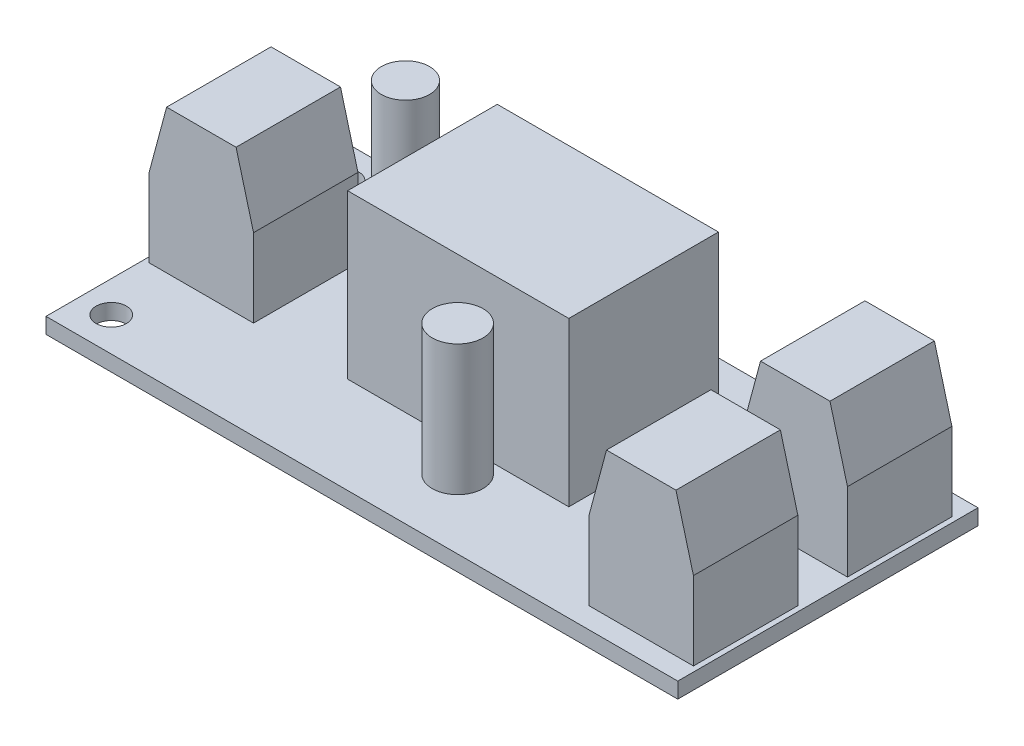
from build123d import *
from OCP.BRepFilletAPI import BRepFilletAPI_MakeChamfer

# Parameters (mm, degrees)
SKETCH1_W                   = 61.468
SKETCH1_H                   = 29.21
BOSS_EXTRUDE1_DEPTH         = 0.762
F_32_0_116_DIAMETER_HOLE1_D = 2.9464
SKETCH4_W                   = 10.16
SKETCH4_H                   = 10.16
BOSS_EXTRUDE2_DEPTH         = 13.97
SKETCH5_W                   = 10.16
SKETCH5_H                   = 10.16
BOSS_EXTRUDE3_DEPTH         = 13.97
CHAMFER1_SIZE               = 6.35
CHAMFER1_SIZE2              = 1.701477372
SKETCH6_R                   = 2.3495
BOSS_EXTRUDE4_DEPTH         = 12.7
SKETCH7_W                   = 21.517957465
SKETCH7_H                   = 14.561058099
BOSS_EXTRUDE5_DEPTH         = 15.875
SKETCH8_R                   = 2.468766422
BOSS_EXTRUDE6_DEPTH         = 12.7


with BuildPart() as part:
    # Sketch1 → Boss-Extrude1 (new, symmetric)
    with BuildSketch(Plane(origin=(0, 0, 0), x_dir=(1, 0, 0), z_dir=(0, 1, 0))):
        Rectangle(SKETCH1_W, SKETCH1_H)
    extrude(amount=BOSS_EXTRUDE1_DEPTH, both=True)

    # #32 (0.116) Diameter Hole1 (through all)
    with Locations(Plane(origin=(0, 0.762, 0), x_dir=(1, 0, 0), z_dir=(0, 1, 0))):
        with Locations((-27.686, 11.303), (-27.686, -11.303)):
            Hole(F_32_0_116_DIAMETER_HOLE1_D / 2)

    # Sketch4 → Boss-Extrude2 (add)
    with BuildSketch(Plane(origin=(0, 0.762, 0), x_dir=(1, 0, 0), z_dir=(0, 1, 0))):
        with Locations((-25.146, 0)):
            Rectangle(SKETCH4_W, SKETCH4_H)
    extrude(amount=BOSS_EXTRUDE2_DEPTH)

    # Sketch5 → Boss-Extrude3 (add)
    with BuildSketch(Plane(origin=(0, 0.762, 0), x_dir=(1, 0, 0), z_dir=(0, 1, 0))):
        with Locations((25.146, 7.493)):
            Rectangle(SKETCH5_W, SKETCH5_H)
        with Locations((25.146, -7.493)):
            Rectangle(SKETCH5_W, SKETCH5_H)
    extrude(amount=BOSS_EXTRUDE3_DEPTH)

    # Chamfer1: one chamfer whose edges measure the first distance from different faces: ONE call of the kernel's chamfer builder (chamfer() names one face for all edges)
    chamfer1_edges_1 = [part.edges().sort_by_distance(p)[0] for p in [
        (-30.226, 14.732, 0),
    ]]
    chamfer1_side_1 = [part.faces().sort_by_distance(p)[0] for p in [
        (-30.226, 7.747, 0),
    ]]
    chamfer1_edges_2 = [part.edges().sort_by_distance(p)[0] for p in [
        (-20.066, 14.732, 0),
    ]]
    chamfer1_side_2 = [part.faces().sort_by_distance(p)[0] for p in [
        (-20.066, 7.747, 0),
    ]]
    chamfer1_edges_3 = [part.edges().sort_by_distance(p)[0] for p in [
        (20.066, 14.732, -7.493),
    ]]
    chamfer1_side_3 = [part.faces().sort_by_distance(p)[0] for p in [
        (20.066, 7.747, -7.493),
    ]]
    chamfer1_edges_4 = [part.edges().sort_by_distance(p)[0] for p in [
        (30.226, 14.732, -7.493),
    ]]
    chamfer1_side_4 = [part.faces().sort_by_distance(p)[0] for p in [
        (30.226, 7.747, -7.493),
    ]]
    chamfer1_edges_5 = [part.edges().sort_by_distance(p)[0] for p in [
        (20.066, 14.732, 7.493),
    ]]
    chamfer1_side_5 = [part.faces().sort_by_distance(p)[0] for p in [
        (20.066, 7.747, 7.493),
    ]]
    chamfer1_edges_6 = [part.edges().sort_by_distance(p)[0] for p in [
        (30.226, 14.732, 7.493),
    ]]
    chamfer1_side_6 = [part.faces().sort_by_distance(p)[0] for p in [
        (30.226, 7.747, 7.493),
    ]]
    chamfer1 = BRepFilletAPI_MakeChamfer(part.part.solid().wrapped)
    for e in chamfer1_edges_1:
        chamfer1.Add(CHAMFER1_SIZE, CHAMFER1_SIZE2, e.wrapped, chamfer1_side_1[0].wrapped)  # the first distance lies on this face
    for e in chamfer1_edges_2:
        chamfer1.Add(CHAMFER1_SIZE, CHAMFER1_SIZE2, e.wrapped, chamfer1_side_2[0].wrapped)  # the first distance lies on this face
    for e in chamfer1_edges_3:
        chamfer1.Add(CHAMFER1_SIZE, CHAMFER1_SIZE2, e.wrapped, chamfer1_side_3[0].wrapped)  # the first distance lies on this face
    for e in chamfer1_edges_4:
        chamfer1.Add(CHAMFER1_SIZE, CHAMFER1_SIZE2, e.wrapped, chamfer1_side_4[0].wrapped)  # the first distance lies on this face
    for e in chamfer1_edges_5:
        chamfer1.Add(CHAMFER1_SIZE, CHAMFER1_SIZE2, e.wrapped, chamfer1_side_5[0].wrapped)  # the first distance lies on this face
    for e in chamfer1_edges_6:
        chamfer1.Add(CHAMFER1_SIZE, CHAMFER1_SIZE2, e.wrapped, chamfer1_side_6[0].wrapped)  # the first distance lies on this face
    add(Compound.cast(chamfer1.Shape()), mode=Mode.REPLACE)

    # Sketch6 → Boss-Extrude4 (add)
    with BuildSketch(Plane(origin=(0, 0.762, 0), x_dir=(1, 0, 0), z_dir=(0, 1, 0))):
        with Locations(Location((-20.420225117, 10.051406146, 0), (0, 0, 270))):
            Circle(SKETCH6_R)
    extrude(amount=BOSS_EXTRUDE4_DEPTH)

    # Sketch7 → Boss-Extrude5 (add)
    with BuildSketch(Plane(origin=(0, 0.762, 0), x_dir=(1, 0, 0), z_dir=(0, 1, 0))):
        with Locations((-0.009722788, 2.057247528)):
            Rectangle(SKETCH7_W, SKETCH7_H)
    extrude(amount=BOSS_EXTRUDE5_DEPTH)

    # Sketch8 → Boss-Extrude6 (add)
    with BuildSketch(Plane(origin=(0, 0.762, 0), x_dir=(1, 0, 0), z_dir=(0, 1, 0))):
        with Locations(Location((2.574570697, -7.864784458, 0), (0, 0, 270))):
            Circle(SKETCH8_R)
    extrude(amount=BOSS_EXTRUDE6_DEPTH)


solid = part.part
